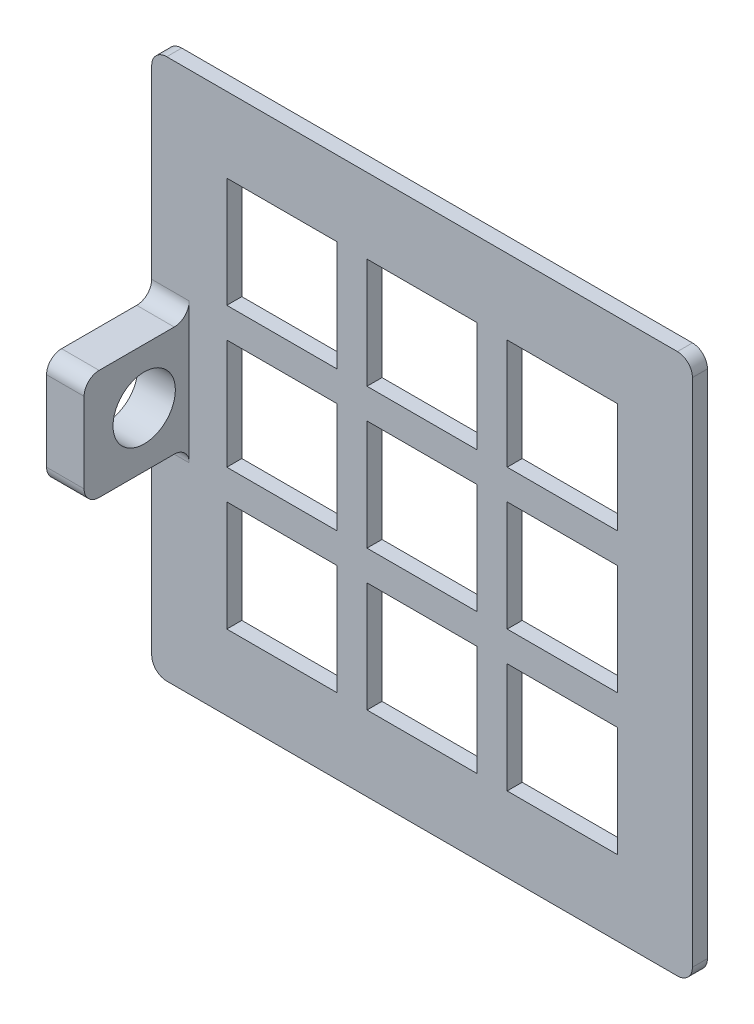
from build123d import *

# Parameters (mm, degrees)
SKETCH1_W                  = 36
SKETCH1_H                  = 36
BOSS_EXTRUDE1_DEPTH        = 10
SKETCH2_W                  = 7.333333333
SKETCH2_H                  = 7.333333333
SKETCH2_H_2                = 7.333333334
SKETCH2_W_2                = 7.333333334
CUT_EXTRUDE1_DEPTH         = 28.349588662
SKETCH6_W                  = 36
SKETCH6_H                  = 36
CUT_EXTRUDE3_DEPTH         = 7
SKETCH9_W                  = 31.197314423
SKETCH9_H                  = 36.13311488
CUT_EXTRUDE5_DEPTH         = 2
SKETCH13_W                 = 5
SKETCH13_H                 = 36
BOSS_EXTRUDE2_DEPTH        = 10
F_4_1_4_1_DIAMETER_SLOT1_D = 4.15
CUT_EXTRUDE6_DEPTH         = 42.048751504
FILLET1_R                  = 1
CUT_EXTRUDE7_START         = -7
SKETCH17_W                 = 2.5
SKETCH17_H                 = 7.333333334
CUT_EXTRUDE7_DEPTH         = 7
FILLET2_R                  = 1


with BuildPart() as part:
    # Sketch1 → Boss-Extrude1 (new body)
    with BuildSketch(Plane.XY):
        Rectangle(SKETCH1_W, SKETCH1_H)
    extrude(amount=BOSS_EXTRUDE1_DEPTH)

    # Sketch2 → Cut-Extrude1 (cut, through all)
    with BuildSketch(Plane.XY.offset(10)):
        with Locations((-9.333333334, 9.333333334)):
            Rectangle(SKETCH2_W, SKETCH2_H)
        with Locations((-9.333333334, 0)):
            Rectangle(SKETCH2_W, SKETCH2_H_2)
        with Locations((0, 9.333333334)):
            Rectangle(SKETCH2_W_2, SKETCH2_H)
        Rectangle(SKETCH2_W_2, SKETCH2_H_2)
        with Locations((9.333333334, 9.333333334)):
            Rectangle(SKETCH2_W, SKETCH2_H)
        with Locations((9.333333334, 0)):
            Rectangle(SKETCH2_W, SKETCH2_H_2)
        with Locations((9.333333334, -9.333333334)):
            Rectangle(SKETCH2_W, SKETCH2_H)
        with Locations((0, -9.333333334)):
            Rectangle(SKETCH2_W_2, SKETCH2_H)
        with Locations((-9.333333334, -9.333333334)):
            Rectangle(SKETCH2_W, SKETCH2_H)
    extrude(amount=-CUT_EXTRUDE1_DEPTH, mode=Mode.SUBTRACT)

    # Sketch6 → Cut-Extrude3 (cut)
    with BuildSketch(Plane(origin=(0, 0, 0), x_dir=(-1, 0, 0), z_dir=(0, 0, -1))):
        Rectangle(SKETCH6_W, SKETCH6_H)
    extrude(amount=-CUT_EXTRUDE3_DEPTH, mode=Mode.SUBTRACT)

    # Sketch9 → Cut-Extrude5 (cut)
    with BuildSketch(Plane.XY.offset(10)):
        with Locations((2.598657212, 0.06655744)):
            Rectangle(SKETCH9_W, SKETCH9_H)
    extrude(amount=-CUT_EXTRUDE5_DEPTH, mode=Mode.SUBTRACT)

    # Sketch13 → Boss-Extrude2 (add)
    with BuildSketch(Plane.XY.offset(10)):
        with Locations((-15.5, 0)):
            Rectangle(SKETCH13_W, SKETCH13_H)
    extrude(amount=BOSS_EXTRUDE2_DEPTH)

    # Ø4.1 (4.1) Diameter Slot1 (through all)
    with Locations(Plane(origin=(-13, 0, 0), x_dir=(0, 0, -1), z_dir=(1, 0, 0))):
        with Locations((-11, 0)):
            Hole(F_4_1_4_1_DIAMETER_SLOT1_D / 2)

    # Sketch16 → Cut-Extrude6 (cut, through all)
    with BuildSketch(Plane(origin=(-13, 0, 0), x_dir=(0, 0, -1), z_dir=(1, 0, 0))):
        Polygon((-8, -18), (-8, -3.666666667), (-15, -3.666666667), (-15, 3.666666667), (-8, 3.666666667), (-8, 18), (-20, 18), (-20, -18), align=None)
    extrude(amount=-CUT_EXTRUDE6_DEPTH, mode=Mode.SUBTRACT)

    # Fillet1
    fillet1_edges = [part.edges().sort_by_distance(p)[0] for p in [
        (18, -18, 7.5),
        (18, 18, 7.5),
        (-18, -18, 7.5),
        (-18, 18, 7.5),
        (-15.5, 3.666666667, 15),
        (-15.5, -3.666666667, 15),
    ]]
    fillet(fillet1_edges, radius=FILLET1_R)

    # Sketch17 → Cut-Extrude7 (cut)
    with BuildSketch(Plane.XY.offset(15).offset(CUT_EXTRUDE7_START)):
        with Locations((-14.25, 0)):
            Rectangle(SKETCH17_W, SKETCH17_H)
    extrude(amount=CUT_EXTRUDE7_DEPTH, mode=Mode.SUBTRACT)

    # Fillet2
    fillet2_edges = [part.edges().sort_by_distance(p)[0] for p in [
        (-16.75, 3.666666667, 8),
        (-16.75, -3.666666667, 8),
    ]]
    fillet(fillet2_edges, radius=FILLET2_R)


solid = part.part
